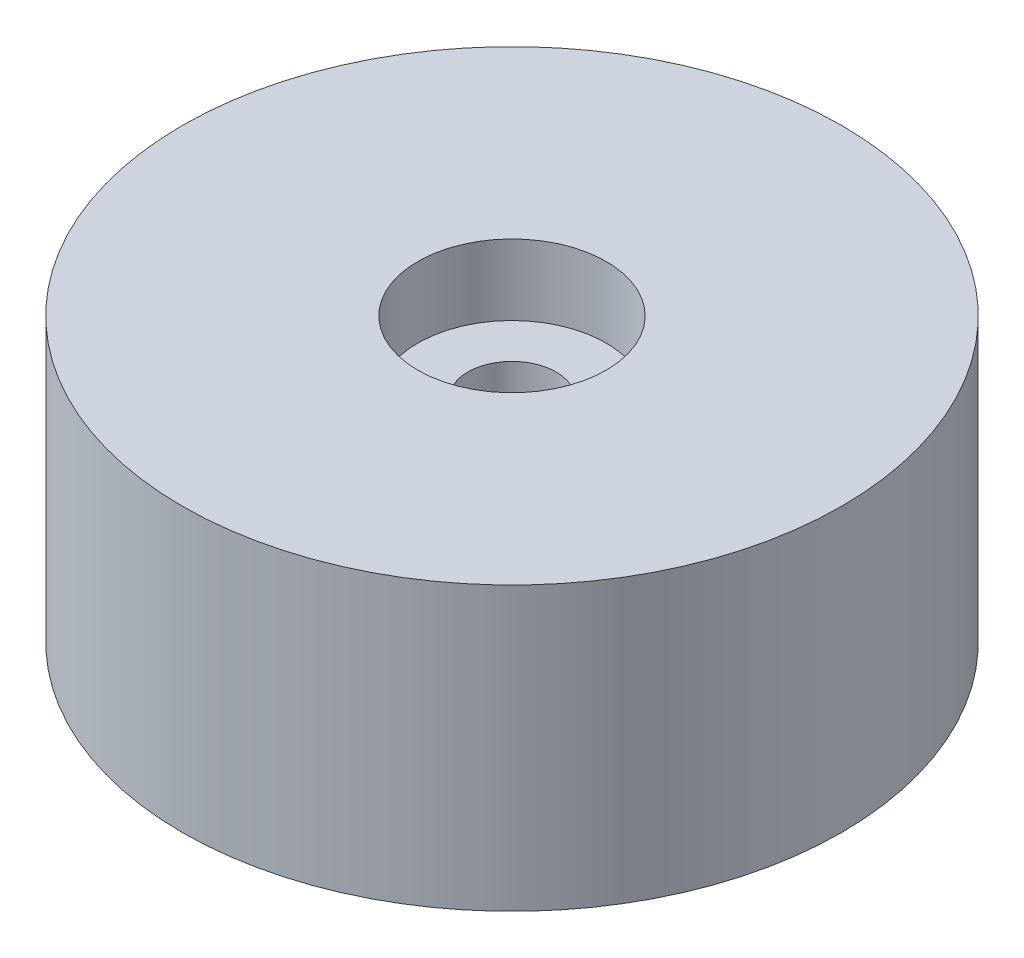
from build123d import *

# Parameters (mm, degrees)
SKETCH_1_R          = 5.6
EXTRUDE_1_DEPTH     = 4.8
SKETCH_2_R          = 0.75
CUT_EXTRUDE_1_DEPTH = 10.260669522
SKETCH_2_3_R        = 1.6
CUT_EXTRUDE_2_DEPTH = 1.2
CUT_EXTRUDE_START   = -3.6
SKETCH_2_4_R        = 1.6
CUT_EXTRUDE_3_DEPTH = 1.2


with BuildPart() as part:
    # 草图1 → 凸台-拉伸1 (new body)
    with BuildSketch(Plane(origin=(0, 0, 0), x_dir=(1, 0, 0), z_dir=(0, 1, 0))):
        with Locations(Location((0, 0, 0), (0, 0, 270))):
            Circle(SKETCH_1_R)
    extrude(amount=EXTRUDE_1_DEPTH)

    # 草图2 → 切除-拉伸1 (cut, through all)
    with BuildSketch(Plane(origin=(0, 4.8, 0), x_dir=(1, 0, 0), z_dir=(0, 1, 0))):
        with Locations(Location((0, 0, 0), (0, 0, 270))):
            Circle(SKETCH_2_R)
    extrude(amount=-CUT_EXTRUDE_1_DEPTH, mode=Mode.SUBTRACT)

    # 草图2<3> → 切除-拉伸2 (cut)
    with BuildSketch(Plane(origin=(0, 4.8, 0), x_dir=(1, 0, 0), z_dir=(0, 1, 0))):
        with Locations(Location((0, 0, 0), (0, 0, 270))):
            Circle(SKETCH_2_3_R)
    extrude(amount=-CUT_EXTRUDE_2_DEPTH, mode=Mode.SUBTRACT)

    # 草图2<4> → 切除-拉伸3 (cut)
    with BuildSketch(Plane(origin=(0, 4.8, 0), x_dir=(1, 0, 0), z_dir=(0, 1, 0)).offset(CUT_EXTRUDE_START)):
        with Locations(Location((0, 0, 0), (0, 0, 270))):
            Circle(SKETCH_2_4_R)
    extrude(amount=-CUT_EXTRUDE_3_DEPTH, mode=Mode.SUBTRACT)


solid = part.part
